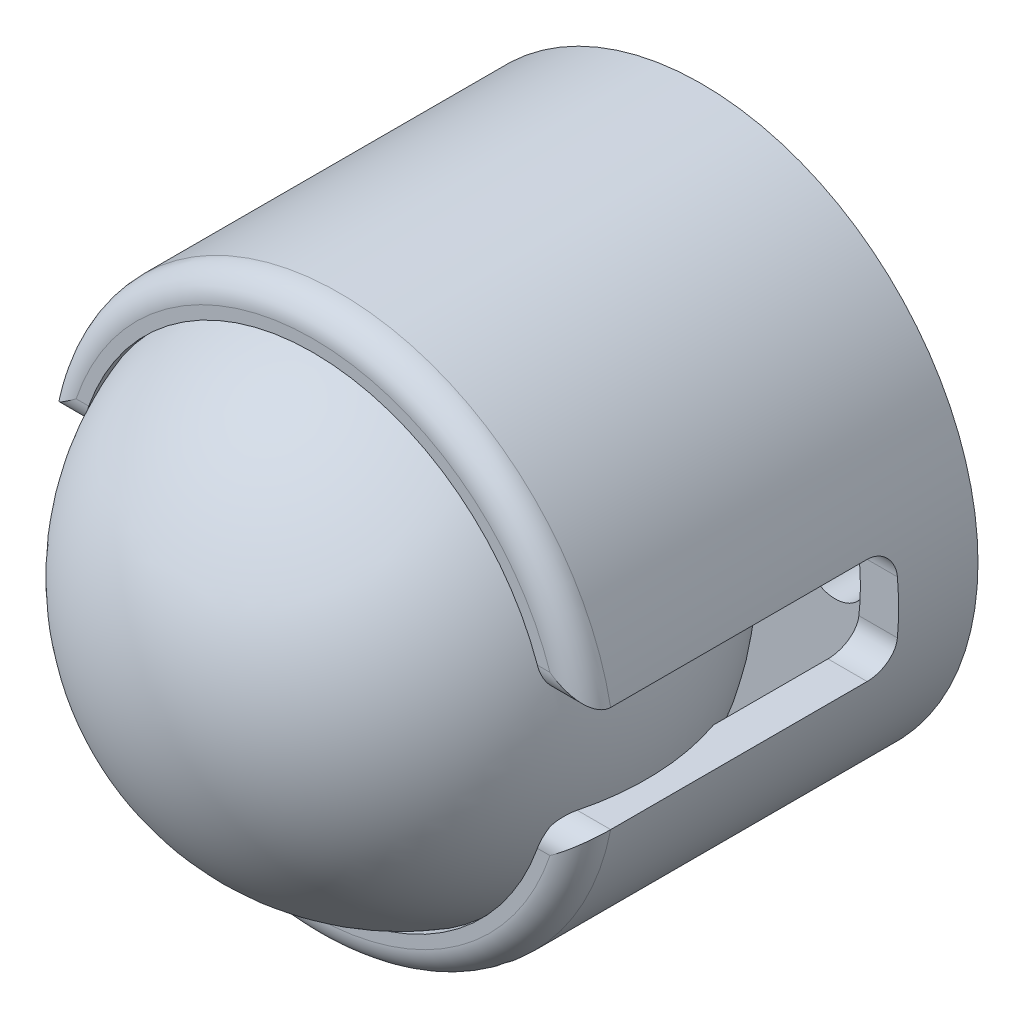
from build123d import *

# Parameters (mm, degrees)
SKETCH1_R            = 10.45
SKETCH1_R_2          = 1.2
SKETCH1_R_3          = 5.5
SOCKET_DEPTH         = 14.7
SKETCH5_R            = 9
COUNTERBORE_DEPTH    = 12
SIDE_SLOT_DEPTH      = 21.844543651
SIDE_SLOT_DEPTH_BACK = 21.844543651
SKETCH4_W            = 11.7
SKETCH4_H            = 4
LIP_FILLET_R         = 1
FILLET3_R            = 1


with BuildPart() as part:
    # Sketch1 → socket (new body)
    with BuildSketch(Plane.XY):
        Circle(SKETCH1_R)
        with Locations((-7.75, 0)):
            Circle(SKETCH1_R_2, mode=Mode.SUBTRACT)
        with Locations((7.75, 0)):
            Circle(SKETCH1_R_2, mode=Mode.SUBTRACT)
        Circle(SKETCH1_R_3, mode=Mode.SUBTRACT)
    extrude(amount=SOCKET_DEPTH)

    # Sketch5 → counterbore (cut)
    with BuildSketch(Plane.XY.offset(14.7)):
        Circle(SKETCH5_R)
    extrude(amount=-COUNTERBORE_DEPTH, mode=Mode.SUBTRACT)

    # Sketch4 → side slot (cut, two sides: drawn at the far end of the back side and taken through both)
    with BuildSketch(Plane(origin=(0, 0, 0), x_dir=(0, 0, -1), z_dir=(1, 0, 0)).offset(-SIDE_SLOT_DEPTH_BACK)):
        with Locations((-8.85, 0)):
            Rectangle(SKETCH4_W, SKETCH4_H)
    extrude(amount=SIDE_SLOT_DEPTH + SIDE_SLOT_DEPTH_BACK, mode=Mode.SUBTRACT)

    # lip Fillet
    lip_fillet_edges = [part.edges().sort_by_distance(p)[0] for p in [
        (0, 10.45, 14.7),
        (0, -10.45, 14.7),
        (-9.515895691, -2, 14.7),
        (9.515895691, -2, 14.7),
        (9.515895691, 2, 14.7),
        (-9.515895691, 2, 14.7),
    ]]
    fillet(lip_fillet_edges, radius=LIP_FILLET_R)

    # Sketch3 → rollerball (revolve)
    with BuildSketch(Plane(origin=(0, 0, 0), x_dir=(0, 0, -1), z_dir=(1, 0, 0))):
        with BuildLine():
            Line((-20.875, 0), (-11.375, 0))
            Line((-11.375, 0), (-1.875, 0))
            ThreePointArc((-1.875, 0), (-11.375, 9.5), (-20.875, 0))
        make_face()
    revolve(axis=Axis((0, 0, 20.875), (0, 0, -1)))

    # Fillet3
    fillet3_edges = [part.edges().sort_by_distance(p)[0] for p in [
        (9.515895691, 2, 3),
        (-9.515895691, 2, 3),
        (-9.515895691, -2, 3),
        (9.515895691, -2, 3),
    ]]
    fillet(fillet3_edges, radius=FILLET3_R)


solid = part.part
